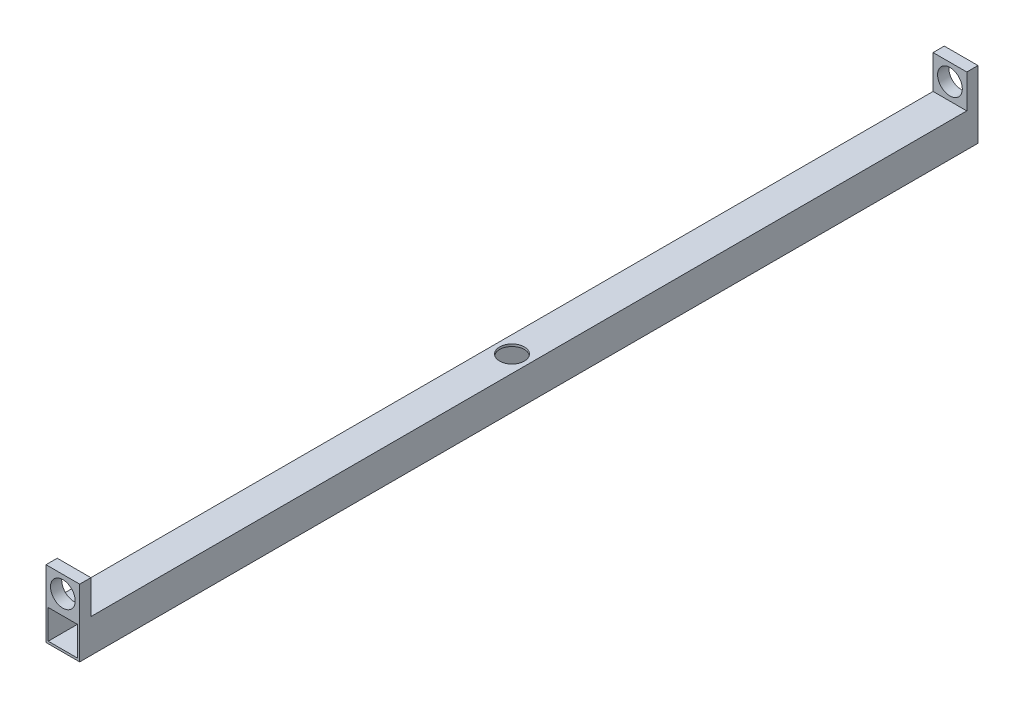
from build123d import *

# Parameters (mm, degrees)
SKETCH1_W           = 30
SKETCH1_H           = 30
SKETCH1_W_2         = 26
SKETCH1_H_2         = 26
BOSS_EXTRUDE1_DEPTH = 800
SKETCH2_W           = 30
SKETCH2_H           = 30
SKETCH2_R           = 11
BOSS_EXTRUDE2_DEPTH = 10
BOSS_EXTRUDE3_START = -10
SKETCH3_W           = 30
SKETCH3_H           = 30
SKETCH3_R           = 11
BOSS_EXTRUDE3_DEPTH = 10
SKETCH4_R           = 11
CUT_EXTRUDE1_DEPTH  = 50


with BuildPart() as part:
    # Sketch1 → Boss-Extrude1 (new body)
    with BuildSketch(Plane.XY):
        Rectangle(SKETCH1_W, SKETCH1_H)
        Rectangle(SKETCH1_W_2, SKETCH1_H_2, mode=Mode.SUBTRACT)
    extrude(amount=BOSS_EXTRUDE1_DEPTH)

    # Sketch2 → Boss-Extrude2 (add)
    with BuildSketch(Plane(origin=(0, 0, 0), x_dir=(-1, 0, 0), z_dir=(0, 0, -1))):
        with Locations((0, 30)):
            Rectangle(SKETCH2_W, SKETCH2_H)
        with Locations((0, 30)):
            Circle(SKETCH2_R, mode=Mode.SUBTRACT)
    extrude(amount=-BOSS_EXTRUDE2_DEPTH)

    # Sketch3 → Boss-Extrude3 (add)
    with BuildSketch(Plane.XY.offset(800).offset(BOSS_EXTRUDE3_START)):
        with Locations((0, 30)):
            Rectangle(SKETCH3_W, SKETCH3_H)
        with Locations(Location((0, 30, 0), (0, 0, 180))):
            Circle(SKETCH3_R, mode=Mode.SUBTRACT)
    extrude(amount=BOSS_EXTRUDE3_DEPTH)

    # Sketch4 → Cut-Extrude1 (cut)
    with BuildSketch(Plane.XZ.offset(15)):
        with Locations(Location((0, 400, 0), (0, 0, 270))):
            Circle(SKETCH4_R)
    extrude(amount=-CUT_EXTRUDE1_DEPTH, mode=Mode.SUBTRACT)


solid = part.part
